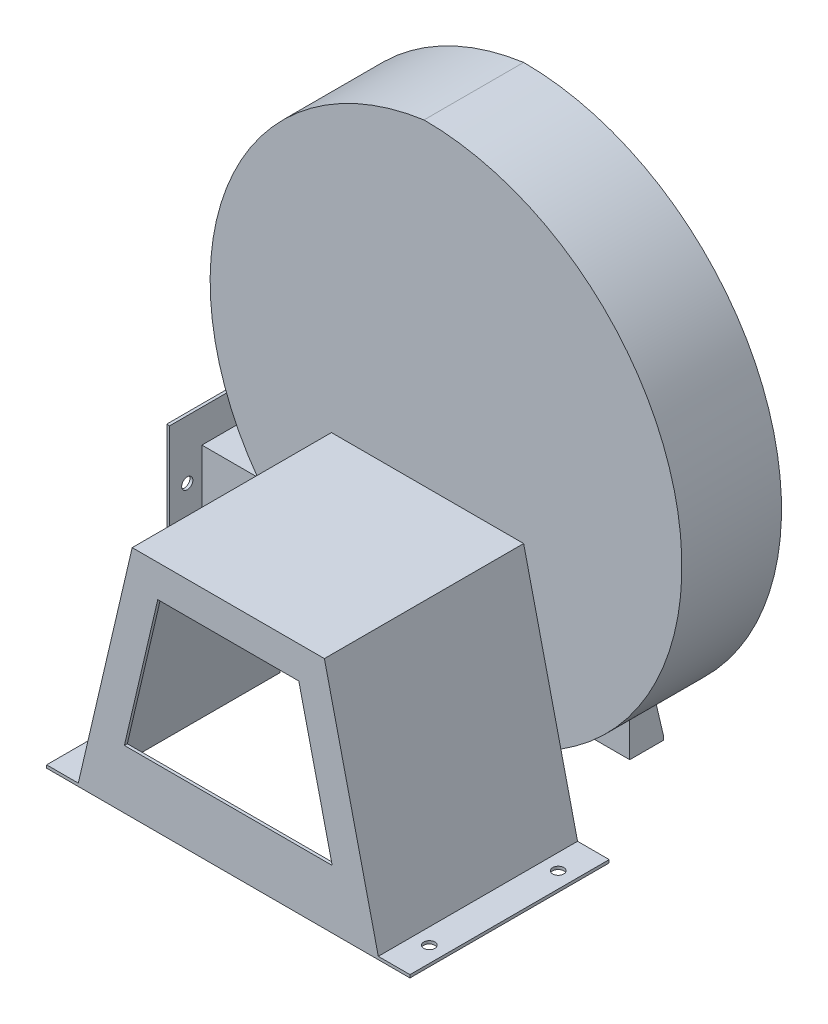
from build123d import *

# Parameters (mm, degrees)
SALIENTE_EXTRUIR1_DEPTH  = 170
SALIENTE_EXTRUIR2_DEPTH  = 2.5
CROQUIS4_R               = 4.7625
CORTAR_EXTRUIR1_DEPTH    = 2.5
SALIENTE_EXTRUIR3_DEPTH  = 2.5
SALIENTE_EXTRUIR4_DEPTH  = 80
SALIENTE_EXTRUIR5_DEPTH  = 2.5
CROQUIS8_W               = 140
CROQUIS8_H               = 161
CROQUIS8_W_2             = 80
CROQUIS8_H_2             = 101
SALIENTE_EXTRUIR6_DEPTH  = 2.5
CROQUIS9_R               = 4.7625
CORTAR_EXTRUIR2_DEPTH    = 2.5
CROQUIS10_R              = 61
CORTAR_EXTRUIR3_DEPTH    = 2.5
SALIENTE_EXTRUIR7_START  = 28.5
CROQUIS11_R              = 63.5
CROQUIS11_R_2            = 61
SALIENTE_EXTRUIR7_DEPTH  = 28.5
CROQUIS12_R              = 88
CROQUIS12_R_2            = 61
SALIENTE_EXTRUIR8_DEPTH  = 2.5
CROQUIS13_W              = 175
CROQUIS13_H              = 115
SALIENTE_EXTRUIR9_DEPTH  = 2.5
CROQUIS14_W              = 175
CROQUIS14_H              = 2.5
SALIENTE_EXTRUIR10_DEPTH = 26.5
SALIENTE_EXTRUIR11_DEPTH = 2.5
SALIENTE_EXTRUIR12_DEPTH = 2.5
CROQUIS17_R              = 4.7625
CORTAR_EXTRUIR4_DEPTH    = 2.5
CROQUIS18_R              = 154
SALIENTE_EXTRUIR13_DEPTH = 2.5
CROQUIS19_R              = 3.96875
SALIENTE_EXTRUIR14_DEPTH = 16
MATRIZC1_COUNT           = 6
CROQUIS20_R              = 3.96875
SALIENTE_EXTRUIR15_DEPTH = 7
MATRIZC3_COUNT           = 6


with BuildPart() as part:
    # Croquis1 → Saliente-Extruir1 (new body)
    with BuildSketch(Plane.XY):
        Polygon((0, 0), (29, 0), (75, 197), (235, 197), (281, 0), (310, 0), (310, 2.5), (282.983493442, 2.5), (236.983493442, 199.5), (73.016506558, 199.5), (27.016506558, 2.5), (0, 2.5), align=None)
    extrude(amount=SALIENTE_EXTRUIR1_DEPTH)

    # Croquis2 → Saliente-Extruir2 (add)
    with BuildSketch(Plane.XY.offset(170)):
        Polygon((29, 0), (281, 0), (269.286291687, 50.165229078), (235, 197), (75, 197), (40.713708313, 50.165229078), align=None)
        Polygon((243.652375223, 50), (66.347624777, 50), (94.834934422, 172), (215.165065578, 172), align=None, mode=Mode.SUBTRACT)
    extrude(amount=-SALIENTE_EXTRUIR2_DEPTH)

    # Croquis4 → Cortar-Extruir1 (cut)
    with BuildSketch(Plane(origin=(0, 2.5, 0), x_dir=(1, 0, 0), z_dir=(0, 1, 0))):
        with Locations(Location((13.508253279, -30, 0), (0, 0, 270))):
            Circle(CROQUIS4_R)
        with Locations(Location((13.508253279, -140, 0), (0, 0, 270))):
            Circle(CROQUIS4_R)
        with Locations(Location((296.491746721, -140, 0), (0, 0, 90))):
            Circle(CROQUIS4_R)
        with Locations(Location((296.491746721, -30, 0), (0, 0, 90))):
            Circle(CROQUIS4_R)
    extrude(amount=-CORTAR_EXTRUIR1_DEPTH, mode=Mode.SUBTRACT)

    # Croquis5 → Saliente-Extruir3 (add)
    with BuildSketch(Plane(origin=(0, 0, 0), x_dir=(-1, 0, 0), z_dir=(0, 0, -1))):
        with BuildLine():
            Line((0, 30), (40, 30))
            Line((40, 30), (40, 135))
            Line((40, 135), (-10, 135))
            ThreePointArc((-10, 135), (13.653759217, 342.621891967), (-152, 470))
            ThreePointArc((-152, 470), (-372, 250), (-152, 30))
            Line((-152, 30), (0, 30))
        make_face()
    extrude(amount=SALIENTE_EXTRUIR3_DEPTH)

    # Croquis6 → Saliente-Extruir4 (add)
    with BuildSketch(Plane(origin=(0, 0, -2.5), x_dir=(-1, 0, 0), z_dir=(0, 0, -1))):
        with BuildLine():
            Line((-10, 135), (40, 135))
            Line((40, 135), (40, 133))
            Line((40, 133), (38, 133))
            Line((38, 133), (-13.968512136, 133))
            ThreePointArc((-13.968512136, 133), (12.60152192, 339.954109112), (-152.141403753, 467.99995414))
            ThreePointArc((-152.141403753, 467.99995414), (-369.999988535, 249.92929812), (-152, 32))
            Line((-152, 32), (38, 32))
            Line((38, 32), (40, 32))
            Line((40, 32), (40, 30))
            Line((40, 30), (-152, 30))
            ThreePointArc((-152, 30), (-372, 250), (-152, 470))
            ThreePointArc((-152, 470), (13.653759217, 342.621891967), (-10, 135))
        make_face()
    extrude(amount=SALIENTE_EXTRUIR4_DEPTH)

    # Croquis7 → Saliente-Extruir5 (add)
    with BuildSketch(Plane(origin=(0, 0, -82.5), x_dir=(-1, 0, 0), z_dir=(0, 0, -1))):
        with BuildLine():
            Line((-10, 135), (40, 135))
            Line((40, 135), (40, 30))
            Line((40, 30), (-152, 30))
            ThreePointArc((-152, 30), (-372, 250), (-152, 470))
            ThreePointArc((-152, 470), (13.653759217, 342.621891967), (-10, 135))
        make_face()
    extrude(amount=SALIENTE_EXTRUIR5_DEPTH)

    # Croquis8 → Saliente-Extruir6 (add)
    with BuildSketch(Plane.ZY.offset(40)):
        with Locations((-42.5, 82.5)):
            Rectangle(CROQUIS8_W, CROQUIS8_H)
        with Locations((-42.5, 82.5)):
            Rectangle(CROQUIS8_W_2, CROQUIS8_H_2, mode=Mode.SUBTRACT)
    extrude(amount=-SALIENTE_EXTRUIR6_DEPTH)

    # Croquis9 → Cortar-Extruir2 (cut)
    with BuildSketch(Plane.ZY.offset(40)):
        with Locations((-42.5, 148)):
            Circle(CROQUIS9_R)
        with Locations((-97.5, 113)):
            Circle(CROQUIS9_R)
        with Locations((12.5, 113)):
            Circle(CROQUIS9_R)
        with Locations(Location((12.5, 52, 0), (0, 0, 180))):
            Circle(CROQUIS9_R)
        with Locations(Location((-97.5, 52, 0), (0, 0, 180))):
            Circle(CROQUIS9_R)
        with Locations(Location((-42.5, 17, 0), (0, 0, 180))):
            Circle(CROQUIS9_R)
    extrude(amount=-CORTAR_EXTRUIR2_DEPTH, mode=Mode.SUBTRACT)

    # Croquis10 → Cortar-Extruir3 (cut)
    with BuildSketch(Plane(origin=(0, 0, -85), x_dir=(-1, 0, 0), z_dir=(0, 0, -1))):
        with Locations((-155, 279.5)):
            Circle(CROQUIS10_R)
    extrude(amount=-CORTAR_EXTRUIR3_DEPTH, mode=Mode.SUBTRACT)

    # Croquis11 → Saliente-Extruir7 (add)
    with BuildSketch(Plane(origin=(0, 0, -85), x_dir=(-1, 0, 0), z_dir=(0, 0, -1)).offset(SALIENTE_EXTRUIR7_START)):
        with Locations(Location((-155, 279.5, 0), (0, 0, 180))):
            Circle(CROQUIS11_R)
        with Locations((-155, 279.5)):
            Circle(CROQUIS11_R_2, mode=Mode.SUBTRACT)
    extrude(amount=-SALIENTE_EXTRUIR7_DEPTH)

    # Croquis12 → Saliente-Extruir8 (add)
    with BuildSketch(Plane(origin=(0, 0, -113.5), x_dir=(-1, 0, 0), z_dir=(0, 0, -1))):
        with Locations((-155, 279.5)):
            Circle(CROQUIS12_R)
        with Locations((-155, 279.5)):
            Circle(CROQUIS12_R_2, mode=Mode.SUBTRACT)
    extrude(amount=-SALIENTE_EXTRUIR8_DEPTH)

    # Croquis13 → Saliente-Extruir9 (add)
    with BuildSketch(Plane(origin=(0, 0, -85), x_dir=(-1, 0, 0), z_dir=(0, 0, -1))):
        with Locations((-155, 57.5)):
            Rectangle(CROQUIS13_W, CROQUIS13_H)
    extrude(amount=SALIENTE_EXTRUIR9_DEPTH)

    # Croquis14 → Saliente-Extruir10 (add)
    with BuildSketch(Plane(origin=(0, 0, -87.5), x_dir=(-1, 0, 0), z_dir=(0, 0, -1))):
        with Locations((-155, 1.25)):
            Rectangle(CROQUIS14_W, CROQUIS14_H)
    extrude(amount=SALIENTE_EXTRUIR10_DEPTH)

    # Croquis15 → Saliente-Extruir11 (add)
    with BuildSketch(Plane.ZY.offset(-67.5)):
        Polygon((-114, 2.5), (-87.5, 115), (-85, 115), (-85, 0), (-114, 0), align=None)
    extrude(amount=-SALIENTE_EXTRUIR11_DEPTH)

    # Croquis16 → Saliente-Extruir12 (add)
    with BuildSketch(Plane(origin=(242.5, 0, 0), x_dir=(0, 0, -1), z_dir=(1, 0, 0))):
        Polygon((114, 2.5), (87.5, 115), (85, 115), (85, 0), (114, 0), align=None)
    extrude(amount=-SALIENTE_EXTRUIR12_DEPTH)

    # Croquis17 → Cortar-Extruir4 (cut)
    with BuildSketch(Plane.XZ):
        with Locations(Location((198.5, -100.75, 0), (0, 0, 270))):
            Circle(CROQUIS17_R)
        with Locations(Location((111.5, -100.75, 0), (0, 0, 270))):
            Circle(CROQUIS17_R)
    extrude(amount=-CORTAR_EXTRUIR4_DEPTH, mode=Mode.SUBTRACT)

    # Croquis18 → Saliente-Extruir13 (add)
    with BuildSketch(Plane(origin=(0, 0, -85), x_dir=(-1, 0, 0), z_dir=(0, 0, -1))):
        with Locations(Location((-155, 279.5, 0), (0, 0, 180))):
            Circle(CROQUIS18_R)
    extrude(amount=SALIENTE_EXTRUIR13_DEPTH)

    # Croquis19 → Saliente-Extruir14 (add)
    with BuildSketch(Plane(origin=(0, 0, -87.5), x_dir=(-1, 0, 0), z_dir=(0, 0, -1))):
        with Locations((-13, 279.5)):
            Circle(CROQUIS19_R)
    saliente_extruir14 = extrude(amount=SALIENTE_EXTRUIR14_DEPTH)

    # MatrizC1: Saliente-Extruir14 ×6 about axis
    matrizc1_axis = Axis((155, 279.5, 0), (0, 0, 1))
    for i in range(1, MATRIZC1_COUNT):
        add(saliente_extruir14.rotate(matrizc1_axis, i * 360 / MATRIZC1_COUNT))

    # Croquis20 → Saliente-Extruir15 (add)
    with BuildSketch(Plane(origin=(0, 0, -87.5), x_dir=(-1, 0, 0), z_dir=(0, 0, -1))):
        Polygon((-6.07179677, 279.5), (-9.535898385, 285.5), (-16.464101615, 285.5), (-19.92820323, 279.5), (-16.464101615, 273.5), (-9.535898385, 273.5), align=None)
        with Locations((-13, 279.5)):
            Circle(CROQUIS20_R, mode=Mode.SUBTRACT)
    saliente_extruir15 = extrude(amount=SALIENTE_EXTRUIR15_DEPTH)

    # MatrizC3: Saliente-Extruir15 ×6 about axis
    matrizc3_axis = Axis((155, 279.5, 0), (0, 0, 1))
    for i in range(1, MATRIZC3_COUNT):
        add(saliente_extruir15.rotate(matrizc3_axis, i * 360 / MATRIZC3_COUNT))


solid = part.part
